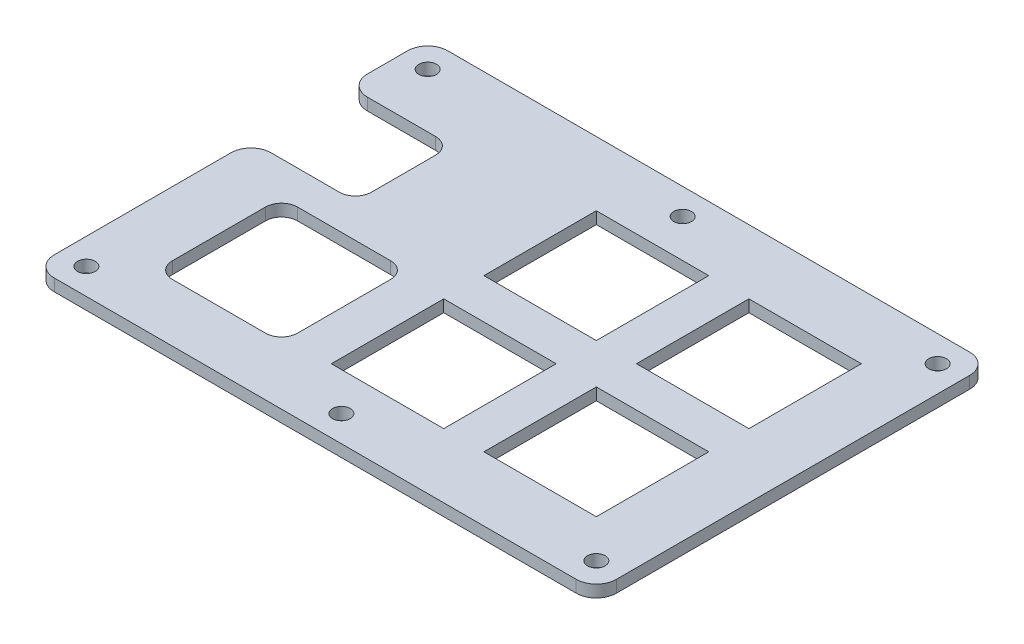
from build123d import *

# Parameters (mm, degrees)
SKETCH1_W            = 40
SKETCH1_H            = 39
BOSS_EXTRUDE1_DEPTH  = 1.5
SKETCH3_W            = 70
SKETCH3_H            = 49
BOSS_EXTRUDE2_DEPTH  = 1.5
SKETCH4_W            = 13
SKETCH4_H            = 12
CUT_EXTRUDE1_DEPTH   = 52.259145525
SKETCH5_W            = 15.6
SKETCH5_H            = 15.6
CUT_EXTRUDE2_DEPTH   = 52.259145525
FILLET2_R            = 2
SKETCH6_R            = 1.1
CUT_EXTRUDE3_DEPTH   = 52.259145525
FILLET4_R            = 2.5
SKETCH7_W            = 14
SKETCH7_H            = 14
CUT_EXTRUDE4_DEPTH   = 52.259145525
LPATTERN1_COUNT      = 2
LPATTERN1_PITCH      = 19
LPATTERN1_COUNT_DIR2 = 2
LPATTERN1_PITCH_DIR2 = 19
FILLET5_R            = 2


with BuildPart() as part:
    # Sketch1 → Boss-Extrude1 (new body)
    with BuildSketch(Plane(origin=(0, 0, 0), x_dir=(1, 0, 0), z_dir=(0, 1, 0))):
        Rectangle(SKETCH1_W, SKETCH1_H)
    extrude(amount=BOSS_EXTRUDE1_DEPTH)

    # Sketch3 → Boss-Extrude2 (add)
    with BuildSketch(Plane(origin=(0, 0, 0), x_dir=(1, 0, 0), z_dir=(0, 1, 0))):
        with Locations((-10, 0)):
            Rectangle(SKETCH3_W, SKETCH3_H)
    extrude(amount=BOSS_EXTRUDE2_DEPTH)

    # Sketch4 → Cut-Extrude1 (cut, through all)
    with BuildSketch(Plane(origin=(0, 1.5, 0), x_dir=(1, 0, 0), z_dir=(0, 1, 0))):
        with Locations((-38.5, 8.5)):
            Rectangle(SKETCH4_W, SKETCH4_H)
    extrude(amount=-CUT_EXTRUDE1_DEPTH, mode=Mode.SUBTRACT)

    # Sketch5 → Cut-Extrude2 (cut, through all)
    with BuildSketch(Plane(origin=(0, 1.5, 0), x_dir=(1, 0, 0), z_dir=(0, 1, 0))):
        with Locations((-29.2, -9.5)):
            Rectangle(SKETCH5_W, SKETCH5_H)
    extrude(amount=-CUT_EXTRUDE2_DEPTH, mode=Mode.SUBTRACT)

    # Fillet2
    fillet2_edges = [part.edges().sort_by_distance(p)[0] for p in [
        (-37, 0.75, 17.3),
        (-37, 0.75, 1.7),
        (-21.4, 0.75, 1.7),
        (-21.4, 0.75, 17.3),
    ]]
    fillet(fillet2_edges, radius=FILLET2_R)

    # Sketch6 → Cut-Extrude3 (cut, through all)
    with BuildSketch(Plane(origin=(0, 1.5, 0), x_dir=(1, 0, 0), z_dir=(0, 1, 0))):
        with Locations(Location((-41.75, 21.25, 0), (0, 0, 270))):
            Circle(SKETCH6_R)
        with Locations(Location((21.75, 21.25, 0), (0, 0, 270))):
            Circle(SKETCH6_R)
        with Locations(Location((21.75, -21.25, 0), (0, 0, 270))):
            Circle(SKETCH6_R)
        with Locations(Location((-41.75, -21.25, 0), (0, 0, 270))):
            Circle(SKETCH6_R)
        with Locations(Location((-10, -21.25, 0), (0, 0, 270))):
            Circle(SKETCH6_R)
        with Locations(Location((-10, 21.25, 0), (0, 0, 270))):
            Circle(SKETCH6_R)
    extrude(amount=-CUT_EXTRUDE3_DEPTH, mode=Mode.SUBTRACT)

    # Fillet4
    fillet4_edges = [part.edges().sort_by_distance(p)[0] for p in [
        (25, 0.75, 24.5),
        (25, 0.75, -24.5),
        (-45, 0.75, -24.5),
        (-45, 0.75, 24.5),
        (-45, 0.75, -2.5),
        (-45, 0.75, -14.5),
    ]]
    fillet(fillet4_edges, radius=FILLET4_R)

    # Sketch7 → Cut-Extrude4 (cut, through all)
    with BuildSketch(Plane(origin=(0, 1.5, 0), x_dir=(1, 0, 0), z_dir=(0, 1, 0))):
        with Locations((-9, 9.5)):
            Rectangle(SKETCH7_W, SKETCH7_H)
    cut_extrude4 = extrude(amount=-CUT_EXTRUDE4_DEPTH, mode=Mode.SUBTRACT)

    # LPattern1: Cut-Extrude4 2 × 2
    with Locations(*[(i * LPATTERN1_PITCH, 0, j * LPATTERN1_PITCH_DIR2) for i in range(LPATTERN1_COUNT) for j in range(LPATTERN1_COUNT_DIR2) if (i, j) != (0, 0)]):
        add(cut_extrude4, mode=Mode.SUBTRACT)

    # Fillet5
    fillet5_edges = [part.edges().sort_by_distance(p)[0] for p in [
        (-32, 0.75, -14.5),
        (-32, 0.75, -2.5),
    ]]
    fillet(fillet5_edges, radius=FILLET5_R)


solid = part.part
